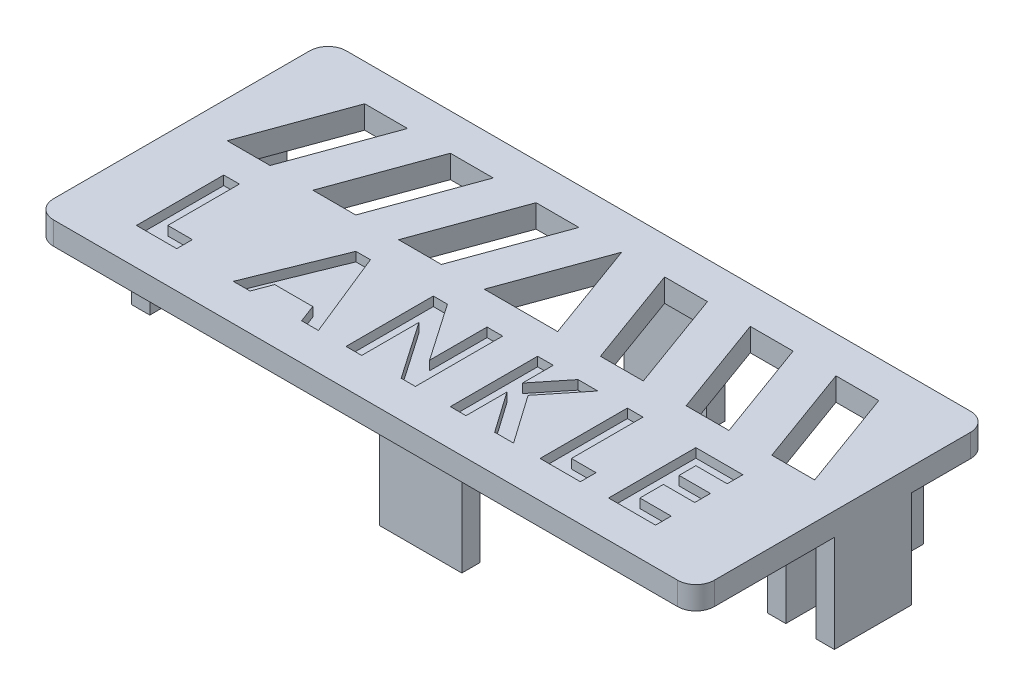
from build123d import *

# Parameters (mm, degrees)
SKETCH1_W           = 72.1
SKETCH1_H           = 31.95
BOSS_EXTRUDE1_DEPTH = 2.5
FILLET1_R           = 2
SKETCH2_W           = 2
SKETCH2_H           = 8.4
SKETCH2_W_2         = 9
SKETCH2_H_2         = 2
BOSS_EXTRUDE2_DEPTH = 10.6
BOSS_EXTRUDE4_DEPTH = 9.75
CUT_EXTRUDE1_DEPTH  = 2.5
CUT_EXTRUDE2_DEPTH  = 1
CUT_EXTRUDE4_DEPTH  = 1
SKETCH8_W           = 15
SKETCH8_H           = 7.5
BOSS_EXTRUDE5_DEPTH = 2


with BuildPart() as part:
    # Sketch1 → Boss-Extrude1 (new body)
    with BuildSketch(Plane(origin=(0, 0, 0), x_dir=(1, 0, 0), z_dir=(0, 1, 0))):
        Rectangle(SKETCH1_W, SKETCH1_H)
    extrude(amount=BOSS_EXTRUDE1_DEPTH)

    # Fillet1
    fillet1_edges = [part.edges().sort_by_distance(p)[0] for p in [
        (36.05, 1.25, 15.975),
        (-36.05, 1.25, 15.975),
        (-36.05, 1.25, -15.975),
        (36.05, 1.25, -15.975),
    ]]
    fillet(fillet1_edges, radius=FILLET1_R)

    # Sketch2 → Boss-Extrude2 (add)
    with BuildSketch(Plane.XZ):
        with Locations((35.05, -3.325)):
            Rectangle(SKETCH2_W, SKETCH2_H)
        with Locations((4, -13.725)):
            Rectangle(SKETCH2_W_2, SKETCH2_H_2)
        with Locations((4, 12.975)):
            Rectangle(SKETCH2_W_2, SKETCH2_H_2)
    extrude(amount=BOSS_EXTRUDE2_DEPTH)

    # Sketch2<3> → Boss-Extrude4 (add)
    with BuildSketch(Plane.XZ):
        Polygon((-32.05, 7.475), (-32.05, -0.925), (-32.05, -7.475), (-34.05, -7.475), (-34.05, -0.925), (-34.05, 7.475), align=None)
    extrude(amount=BOSS_EXTRUDE4_DEPTH)

    # Sketch4 → Cut-Extrude1 (cut)
    with BuildSketch(Plane(origin=(0, 2.5, 0), x_dir=(1, 0, 0), z_dir=(0, 1, 0))):
        Polygon((-32.05, 0.975), (-27.375612096, 0.975), (-23.371939519, 11.975), (-28.046327423, 11.975), align=None)
        Polygon((-22.701224192, 0.975), (-18.697551615, 11.975), (-14.023163712, 11.975), (-18.026836288, 0.975), align=None)
        Polygon((-13.352448385, 0.975), (-9.348775808, 11.975), (-4.674387904, 11.975), (-8.678060481, 0.975), align=None)
        Polygon((0, 11.975), (-4.003672577, 0.975), (4.003672577, 0.975), align=None)
        Polygon((8.678060481, 0.975), (4.674387904, 11.975), (9.348775808, 11.975), (13.352448385, 0.975), align=None)
        Polygon((18.026836288, 0.975), (14.023163712, 11.975), (18.697551615, 11.975), (22.701224192, 0.975), align=None)
        Polygon((23.371939519, 11.975), (27.375612096, 0.975), (32.05, 0.975), (28.046327423, 11.975), align=None)
    extrude(amount=-CUT_EXTRUDE1_DEPTH, mode=Mode.SUBTRACT)

    # Sketch3 → Cut-Extrude2 (cut)
    # profile 1 of 6: a face of its own
    with BuildSketch(Plane(origin=(0, 2.5, 0), x_dir=(1, 0, 0), z_dir=(0, 1, 0))):
        Polygon((-29.003846154, -2.45), (-27.294230769, -2.45), (-27.294230769, -10.265384615), (-24.607692308, -10.265384615), (-24.607692308, -11.975), (-29.003846154, -11.975), align=None)
    # profile 2 of 6: a face of its own
    with BuildSketch(Plane(origin=(0, 2.5, 0), x_dir=(1, 0, 0), z_dir=(0, 1, 0))):
        Polygon((-14.585399639, -2.45), (-12.999807692, -2.45), (-9.153173077, -11.975), (-10.979179687, -11.975), (-11.719504207, -10.021153846), (-15.869519231, -10.021153846), (-16.60984375, -11.975), (-18.433942308, -11.975), align=None)
        Polygon((-13.793557692, -5.004882812), (-15.22078125, -8.311538462), (-12.366334135, -8.311538462), align=None, mode=Mode.SUBTRACT)
    # profile 3 of 6: a face of its own
    with BuildSketch(Plane(origin=(0, 2.5, 0), x_dir=(1, 0, 0), z_dir=(0, 1, 0))):
        Polygon((-6.136923077, -2.45), (-4.597124399, -2.45), (-0.275384615, -8.717953726), (-0.275384615, -2.45), (1.434230769, -2.45), (1.434230769, -11.975), (-0.117016226, -11.975), (-4.427307692, -5.726126803), (-4.427307692, -11.975), (-6.136923077, -11.975), align=None)
    # profile 4 of 6: a face of its own
    with BuildSketch(Plane(origin=(0, 2.5, 0), x_dir=(1, 0, 0), z_dir=(0, 1, 0))):
        Polygon((5.244230769, -2.45), (6.953846154, -2.45), (6.953846154, -5.802448918), (9.655649038, -2.45), (11.813656851, -2.45), (8.419230769, -6.662980769), (12.14375, -11.975), (10.084960938, -11.975), (6.953846154, -7.508248197), (6.953846154, -11.975), (5.244230769, -11.975), align=None)
    # profile 5 of 6: a face of its own
    with BuildSketch(Plane(origin=(0, 2.5, 0), x_dir=(1, 0, 0), z_dir=(0, 1, 0))):
        Polygon((15.037884615, -2.45), (16.7475, -2.45), (16.7475, -10.265384615), (19.434038462, -10.265384615), (19.434038462, -11.975), (15.037884615, -11.975), align=None)
    # profile 6 of 6: a face of its own
    with BuildSketch(Plane(origin=(0, 2.5, 0), x_dir=(1, 0, 0), z_dir=(0, 1, 0))):
        Polygon((22.511346154, -2.45), (27.640192308, -2.45), (27.640192308, -4.159615385), (24.220961538, -4.159615385), (24.220961538, -5.991346154), (27.640192308, -5.991346154), (27.640192308, -7.700961538), (24.220961538, -7.700961538), (24.220961538, -10.265384615), (27.640192308, -10.265384615), (27.640192308, -11.975), (22.511346154, -11.975), align=None)
    extrude(amount=-CUT_EXTRUDE2_DEPTH, mode=Mode.SUBTRACT)

    # Sketch7 → Cut-Extrude4 (cut)
    with BuildSketch(Plane(origin=(0, 2.5, 0), x_dir=(1, 0, 0), z_dir=(0, 1, 0))):
        Polygon((-12.366334135, -8.311538462), (-13.793557692, -5.004882812), (-15.22078125, -8.311538462), align=None)
    extrude(amount=-CUT_EXTRUDE4_DEPTH, mode=Mode.SUBTRACT)

    # Sketch8 → Boss-Extrude5 (add)
    with BuildSketch(Plane.ZY.offset(-34.05)):
        with Locations((-3.325, -3.75)):
            Rectangle(SKETCH8_W, SKETCH8_H)
    extrude(amount=BOSS_EXTRUDE5_DEPTH)


solid = part.part
